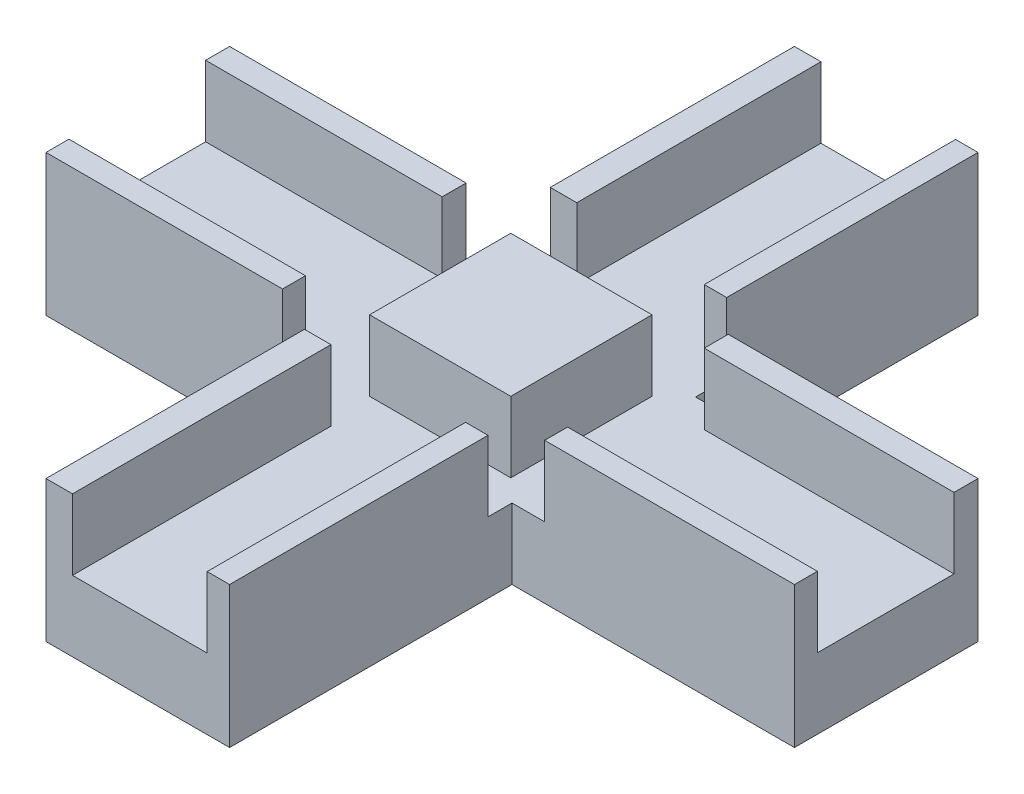
from build123d import *

# Parameters (mm, degrees)
BOSS_EXTRUDE1_DEPTH = 10
SKETCH3_W           = 20
SKETCH3_H           = 20
BOSS_EXTRUDE2_DEPTH = 10
SKETCH4_W           = 33.498835794
SKETCH4_H           = 3.393870965
SKETCH4_H_2         = 3.249417897
SKETCH4_W_2         = 3.755003636
SKETCH4_H_3         = 36.60457676
SKETCH4_W_3         = 3.177191363
SKETCH4_W_4         = 35.376725681
SKETCH4_H_4         = 35.593405283
SKETCH4_H_5         = 34.582233806
BOSS_EXTRUDE3_DEPTH = 10


with BuildPart() as part:
    # Sketch1 → Boss-Extrude1 (new body)
    with BuildSketch(Plane(origin=(0, 0, 0), x_dir=(1, 0, 0), z_dir=(0, 1, 0))):
        Polygon((-12.830188679, 53), (-12.830188679, 13), (-52.830188679, 13), (-52.830188679, -13), (-12.830188679, -13), (-12.830188679, -53), (13.169811321, -53), (13.169811321, -13), (53.169811321, -13), (53.169811321, 13), (13.169811321, 13), (13.169811321, 53), align=None)
    extrude(amount=-BOSS_EXTRUDE1_DEPTH)

    # Sketch3 → Boss-Extrude2 (add)
    with BuildSketch(Plane(origin=(0, 0, 0), x_dir=(1, 0, 0), z_dir=(0, 1, 0))):
        Rectangle(SKETCH3_W, SKETCH3_H)
    extrude(amount=BOSS_EXTRUDE2_DEPTH)

    # Sketch4 → Boss-Extrude3 (add)
    with BuildSketch(Plane(origin=(0, 0, 0), x_dir=(1, 0, 0), z_dir=(0, 1, 0))):
        with Locations((-36.080770782, 11.303064518)):
            Rectangle(SKETCH4_W, SKETCH4_H)
        with Locations((-36.080770782, -11.375291051)):
            Rectangle(SKETCH4_W, SKETCH4_H_2)
        with Locations((-10.952686861, -34.69771162)):
            Rectangle(SKETCH4_W_2, SKETCH4_H_3)
        with Locations((11.58121564, -34.69771162)):
            Rectangle(SKETCH4_W_3, SKETCH4_H_3)
        with Locations((35.481448481, -11.375291051)):
            Rectangle(SKETCH4_W_4, SKETCH4_H_2)
        with Locations((35.481448481, 11.303064518)):
            Rectangle(SKETCH4_W_4, SKETCH4_H)
        with Locations((11.58121564, 35.203297359)):
            Rectangle(SKETCH4_W_3, SKETCH4_H_4)
        with Locations((-10.952686861, 35.708883097)):
            Rectangle(SKETCH4_W_2, SKETCH4_H_5)
    extrude(amount=BOSS_EXTRUDE3_DEPTH)


solid = part.part
